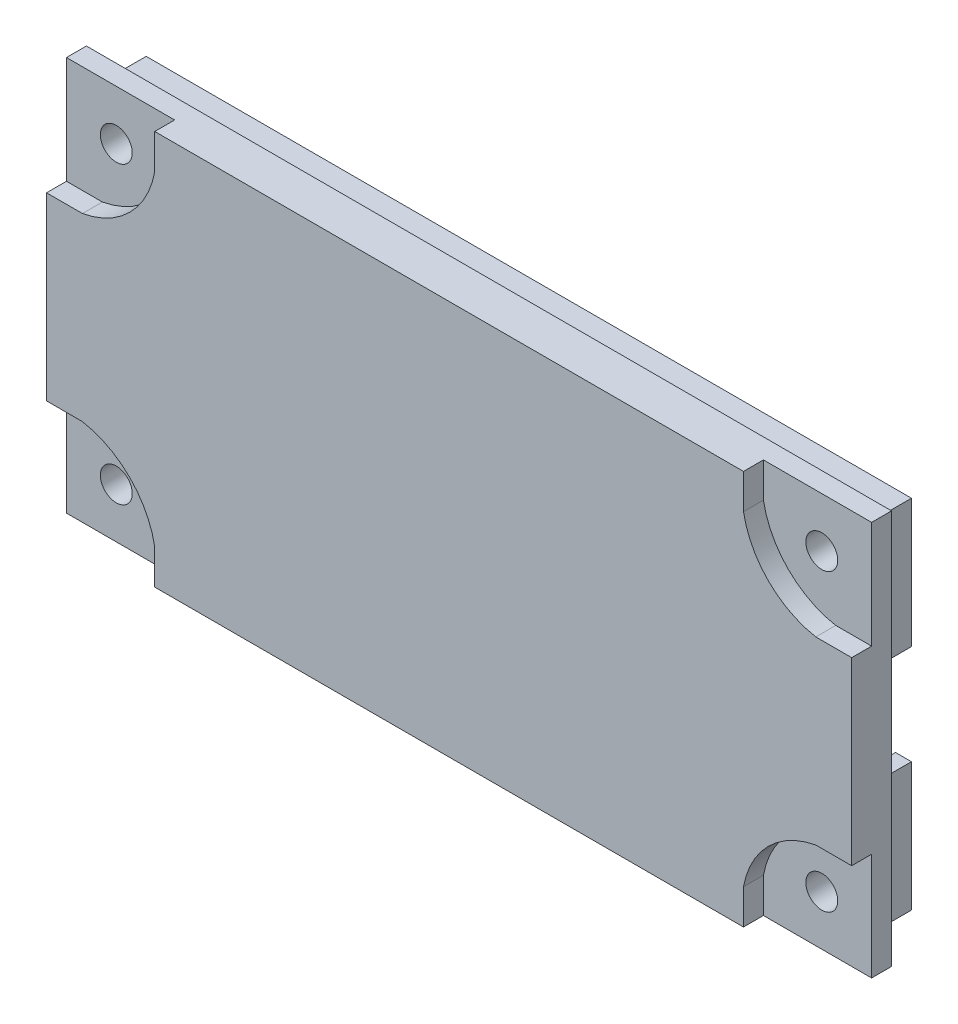
from build123d import *

# Parameters (mm, degrees)
SKETCH_1_W          = 40.4
SKETCH_1_H          = 19.8
EXTRUDE_1_DEPTH     = 2
SKETCH_2_W          = 38.4
SKETCH_2_H          = 17.9
EXTRUDE_2_DEPTH     = 2
CUT_EXTRUDE_6_DEPTH = 1
EXTRUDE_7_DEPTH     = 0.7
SKETCH_4_R          = 0.8
CUT_EXTRUDE_4_DEPTH = 23.848413512
SKETCH_8_W          = 2
SKETCH_8_H          = 5
CUT_EXTRUDE_8_DEPTH = 1.8


with BuildPart() as part:
    # 草圖1 → 伸長1 (new body)
    with BuildSketch(Plane.XY):
        Rectangle(SKETCH_1_W, SKETCH_1_H)
    extrude(amount=EXTRUDE_1_DEPTH)

    # 草圖2 → 伸長2 (add)
    with BuildSketch(Plane(origin=(0, 0, 0), x_dir=(-1, 0, 0), z_dir=(0, 0, 1))):
        Rectangle(SKETCH_2_W, SKETCH_2_H)
        with BuildLine():
            Line((-15.485164876, 8.15), (15.485164876, 8.15))
            ThreePointArc((15.485164876, 8.15), (16.512994231, 6.262994231), (18.4, 5.235164876))
            Line((18.4, 5.235164876), (18.4, -5.235164876))
            ThreePointArc((18.4, -5.235164876), (16.512994231, -6.262994231), (15.485164876, -8.15))
            Line((15.485164876, -8.15), (-15.485164876, -8.15))
            ThreePointArc((-15.485164876, -8.15), (-16.512994231, -6.262994231), (-18.4, -5.235164876))
            Line((-18.4, -5.235164876), (-18.4, 5.235164876))
            ThreePointArc((-18.4, 5.235164876), (-16.512994231, 6.262994231), (-15.485164876, 8.15))
        make_face(mode=Mode.SUBTRACT)
    extrude(amount=-EXTRUDE_2_DEPTH)

    # 草圖5 → 伸長6 (cut)
    with BuildSketch(Plane.XY.offset(2)):
        with BuildLine():
            Line((14.771682035, 8.15), (14.771682035, 9.9))
            Line((14.771682035, 9.9), (20.2, 9.9))
            Line((20.2, 9.9), (20.2, 4.521682035))
            Line((20.2, 4.521682035), (18.4, 4.521682035))
            ThreePointArc((18.4, 4.521682035), (16.018019485, 5.768019485), (14.771682035, 8.15))
        make_face()
        with BuildLine():
            Line((-14.771682035, 8.15), (-14.771682035, 9.9))
            Line((-14.771682035, 9.9), (-20.2, 9.9))
            Line((-20.2, 9.9), (-20.2, 4.521682035))
            Line((-20.2, 4.521682035), (-18.4, 4.521682035))
            ThreePointArc((-18.4, 4.521682035), (-16.018019485, 5.768019485), (-14.771682035, 8.15))
        make_face()
        with BuildLine():
            Line((-18.4, -4.521682035), (-20.2, -4.521682035))
            Line((-20.2, -4.521682035), (-20.2, -9.9))
            Line((-20.2, -9.9), (-14.771682035, -9.9))
            Line((-14.771682035, -9.9), (-14.771682035, -8.15))
            ThreePointArc((-14.771682035, -8.15), (-16.018019485, -5.768019485), (-18.4, -4.521682035))
        make_face()
        with BuildLine():
            Line((14.771682035, -8.15), (14.771682035, -9.9))
            Line((14.771682035, -9.9), (20.2, -9.9))
            Line((20.2, -9.9), (20.2, -4.521682035))
            Line((20.2, -4.521682035), (18.4, -4.521682035))
            ThreePointArc((18.4, -4.521682035), (16.018019485, -5.768019485), (14.771682035, -8.15))
        make_face()
    extrude(amount=-CUT_EXTRUDE_6_DEPTH, mode=Mode.SUBTRACT)

    # 草圖6 → 伸長7 (add)
    with BuildSketch(Plane(origin=(0, 0, 0), x_dir=(-1, 0, 0), z_dir=(0, 0, -1))):
        with BuildLine():
            Line((-19.2, -4.45), (-19.2, -8.95))
            Line((-19.2, -8.95), (-14.7, -8.95))
            ThreePointArc((-14.7, -8.95), (-16.018019485, -5.768019485), (-19.2, -4.45))
        make_face()
        with BuildLine():
            Line((-19.2, 8.95), (-14.7, 8.95))
            ThreePointArc((-14.7, 8.95), (-16.018019485, 5.768019485), (-19.2, 4.45))
            Line((-19.2, 4.45), (-19.2, 8.95))
        make_face()
        with BuildLine():
            Line((19.2, 8.95), (19.2, 4.45))
            ThreePointArc((19.2, 4.45), (16.018019485, 5.768019485), (14.7, 8.95))
            Line((14.7, 8.95), (19.2, 8.95))
        make_face()
        with BuildLine():
            Line((14.7, -8.95), (19.2, -8.95))
            Line((19.2, -8.95), (19.2, -4.45))
            ThreePointArc((19.2, -4.45), (16.018019485, -5.768019485), (14.7, -8.95))
        make_face()
    extrude(amount=EXTRUDE_7_DEPTH)

    # 草圖4 → 伸長4 (cut, through all)
    with BuildSketch(Plane(origin=(0, 0, 2), x_dir=(-1, 0, 0), z_dir=(0, 0, 1))):
        with Locations(Location((-17.7, 7.4, 0), (0, 0, 180))):
            Circle(SKETCH_4_R)
        with Locations(Location((17.7, 7.4, 0), (0, 0, 180))):
            Circle(SKETCH_4_R)
        with Locations(Location((17.7, -7.4, 0), (0, 0, 180))):
            Circle(SKETCH_4_R)
        with Locations(Location((-17.7, -7.4, 0), (0, 0, 180))):
            Circle(SKETCH_4_R)
    extrude(amount=-CUT_EXTRUDE_4_DEPTH, mode=Mode.SUBTRACT)

    # 草圖8 → 伸長8 (cut)
    with BuildSketch(Plane(origin=(20.2, 0, 0), x_dir=(0, 0, -1), z_dir=(1, 0, 0))):
        with Locations((1, 0)):
            Rectangle(SKETCH_8_W, SKETCH_8_H)
    extrude(amount=-CUT_EXTRUDE_8_DEPTH, mode=Mode.SUBTRACT)


solid = part.part
